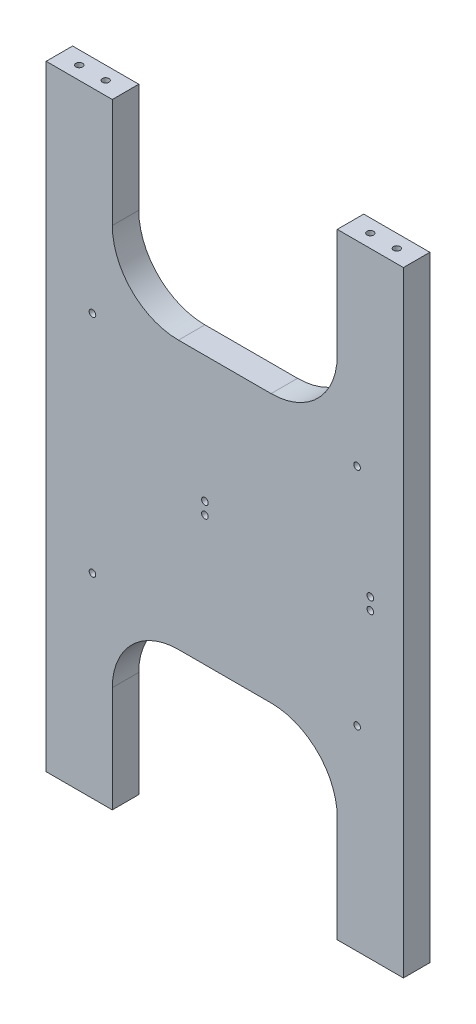
from build123d import *

# Parameters (mm, degrees)
BOSS_EXTRUDE1_DEPTH = 20
SKETCH2_R           = 2.5
CUT_EXTRUDE1_DEPTH  = 20
SKETCH3_R           = 2.5
CUT_EXTRUDE2_DEPTH  = 20
SKETCH4_R           = 2.5
CUT_EXTRUDE3_DEPTH  = 20
SKETCH5_R           = 4
CUT_EXTRUDE4_DEPTH  = 5


with BuildPart() as part:
    # Sketch1 → Boss-Extrude1 (new body)
    with BuildSketch(Plane.XY):
        with BuildLine():
            Line((85, 232.5), (135, 232.5))
            Line((135, 232.5), (135, -232.5))
            Line((135, -232.5), (85, -232.5))
            Line((85, -232.5), (85, -152.5))
            ThreePointArc((85, -152.5), (70.355339059, -117.144660941), (35, -102.5))
            Line((35, -102.5), (-35, -102.5))
            ThreePointArc((-35, -102.5), (-70.355339059, -117.144660941), (-85, -152.5))
            Line((-85, -152.5), (-85, -232.5))
            Line((-85, -232.5), (-135, -232.5))
            Line((-135, -232.5), (-135, 232.5))
            Line((-135, 232.5), (-85, 232.5))
            Line((-85, 232.5), (-85, 150))
            ThreePointArc((-85, 150), (-70.355339059, 114.644660941), (-35, 100))
            Line((-35, 100), (35, 100))
            ThreePointArc((35, 100), (70.355339059, 114.644660941), (85, 150))
            Line((85, 150), (85, 232.5))
        make_face()
    extrude(amount=BOSS_EXTRUDE1_DEPTH)

    # Sketch2 → Cut-Extrude1 (cut)
    with BuildSketch(Plane.XZ.offset(232.5)):
        with Locations((-120, 10)):
            Circle(SKETCH2_R)
        with Locations((-100, 10)):
            Circle(SKETCH2_R)
        with Locations(Location((100, 10, 0), (0, 0, 180))):
            Circle(SKETCH2_R)
        with Locations(Location((120, 10, 0), (0, 0, 180))):
            Circle(SKETCH2_R)
    cut_extrude1 = extrude(amount=-CUT_EXTRUDE1_DEPTH, mode=Mode.SUBTRACT)

    # Mirror1: Cut-Extrude1 across plane
    add(cut_extrude1.mirror(Plane.ZX), mode=Mode.SUBTRACT)

    # Sketch3 → Cut-Extrude2 (cut)
    with BuildSketch(Plane.XY.offset(20)):
        with Locations((100, 85)):
            Circle(SKETCH3_R)
        with Locations(Location((100, -85, 0), (0, 0, 180))):
            Circle(SKETCH3_R)
        with Locations(Location((-100, 85, 0), (0, 0, 180))):
            Circle(SKETCH3_R)
        with Locations((-100, -85)):
            Circle(SKETCH3_R)
    extrude(amount=-CUT_EXTRUDE2_DEPTH, mode=Mode.SUBTRACT)

    # Sketch4 → Cut-Extrude3 (cut)
    with BuildSketch(Plane(origin=(0, 0, 0), x_dir=(-1, 0, 0), z_dir=(0, 0, -1))):
        with Locations((-110, 4.5)):
            Circle(SKETCH4_R)
        with Locations(Location((-110, -4.5, 0), (0, 0, 180))):
            Circle(SKETCH4_R)
        with Locations((15, 4.5)):
            Circle(SKETCH4_R)
        with Locations(Location((15, -4.5, 0), (0, 0, 180))):
            Circle(SKETCH4_R)
    extrude(amount=-CUT_EXTRUDE3_DEPTH, mode=Mode.SUBTRACT)

    # Sketch5 → Cut-Extrude4 (cut)
    with BuildSketch(Plane(origin=(0, 0, 0), x_dir=(-1, 0, 0), z_dir=(0, 0, -1))):
        with Locations((-110, 4.5)):
            Circle(SKETCH5_R)
        with Locations((-110, -4.5)):
            Circle(SKETCH5_R)
        with Locations(Location((15, 4.5, 0), (0, 0, 180))):
            Circle(SKETCH5_R)
        with Locations(Location((15, -4.5, 0), (0, 0, 180))):
            Circle(SKETCH5_R)
    extrude(amount=-CUT_EXTRUDE4_DEPTH, mode=Mode.SUBTRACT)


solid = part.part
